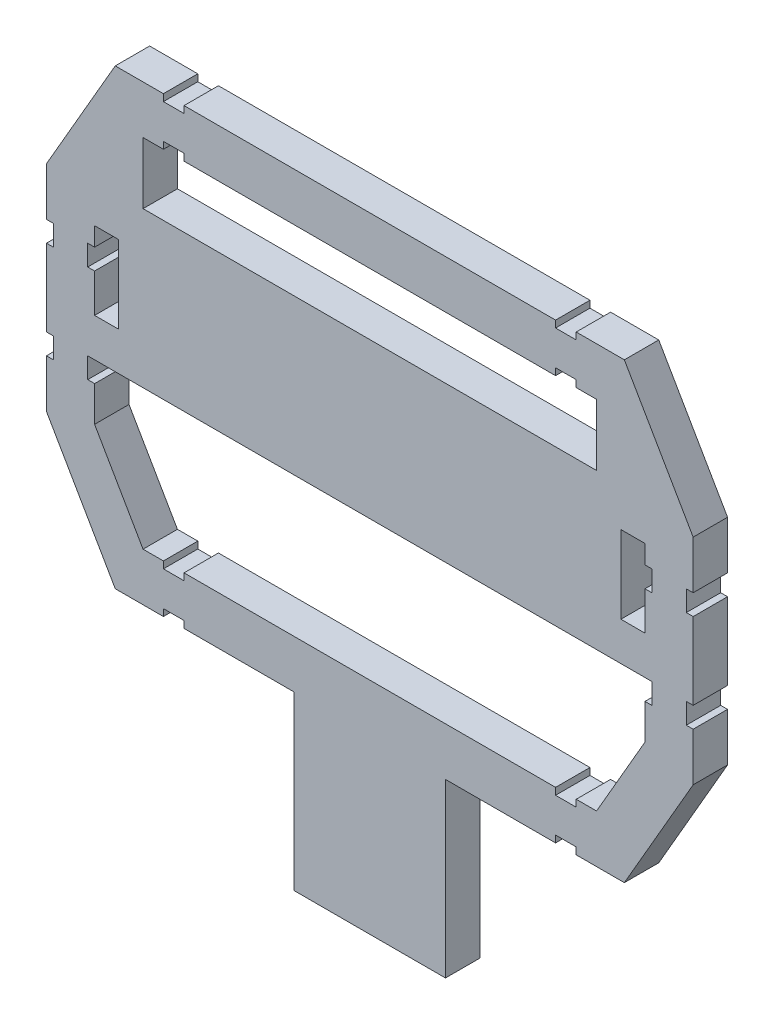
from build123d import *

# Parameters (mm, degrees)
BOSS_EXTRU_1_DEPTH = 5


with BuildPart() as part:
    # Esquisse1 → Boss.-Extru.1 (new body)
    with BuildSketch(Plane.XY):
        Polygon((-32, -29.022213998), (-32, -30.022213998), (-16, -30.022213998), (-16, -55.022213998), (6, -55.022213998), (6, -30.022213998), (22, -30.022213998), (22, -29.022213998), (25, -29.022213998), (25, -30.022213998), (32, -30.022213998), (42, -12.701705922), (42, -5.701705922), (41, -5.701705922), (41, -2.701705922), (42, -2.701705922), (42, 8.475208614), (41, 8.475208614), (41, 11.475208614), (42, 11.475208614), (42, 18.475208614), (32, 35.79571669), (25, 35.79571669), (25, 34.79571669), (22, 34.79571669), (22, 35.79571669), (-32, 35.79571669), (-32, 34.79571669), (-35, 34.79571669), (-35, 35.79571669), (-42, 35.79571669), (-52, 18.475208614), (-52, 11.475208614), (-51, 11.475208614), (-51, 8.475208614), (-52, 8.475208614), (-52, -2.701705922), (-51, -2.701705922), (-51, -5.701705922), (-52, -5.701705922), (-52, -12.701705922), (-42, -30.022213998), (-35, -30.022213998), (-35, -29.022213998), align=None)
        Polygon((-46, -2.701705922), (-45, -2.701705922), (35, -2.701705922), (36, -2.701705922), (36, -5.701705922), (35, -5.701705922), (35, -10.826061575), (27.958548116, -23.022213998), (25, -23.022213998), (25, -24.022213998), (22, -24.022213998), (22, -23.022213998), (-32, -23.022213998), (-32, -24.022213998), (-35, -24.022213998), (-35, -23.022213998), (-37.958548116, -23.022213998), (-45, -10.826061575), (-45, -5.701705922), (-46, -5.701705922), align=None, mode=Mode.SUBTRACT)
        Polygon((-45, 2.886751346), (-45, 8.475208614), (-46, 8.475208614), (-46, 11.475208614), (-45, 11.475208614), (-45, 14.177208614), (-41.5, 14.177208614), (-41.5, 2.886751346), align=None, mode=Mode.SUBTRACT)
        Polygon((-32, 29.79571669), (-32, 28.79571669), (22, 28.79571669), (22, 29.79571669), (25, 29.79571669), (25, 28.79571669), (27.958548116, 28.79571669), (27.958548116, 19.842608257), (-37.958548116, 19.842608257), (-37.958548116, 28.79571669), (-35, 28.79571669), (-35, 29.79571669), align=None, mode=Mode.SUBTRACT)
        Polygon((35, 8.475208614), (35, 2.886751346), (31.5, 2.886751346), (31.5, 14.177208614), (35, 14.177208614), (35, 11.475208614), (36, 11.475208614), (36, 8.475208614), align=None, mode=Mode.SUBTRACT)
    extrude(amount=BOSS_EXTRU_1_DEPTH)


solid = part.part
